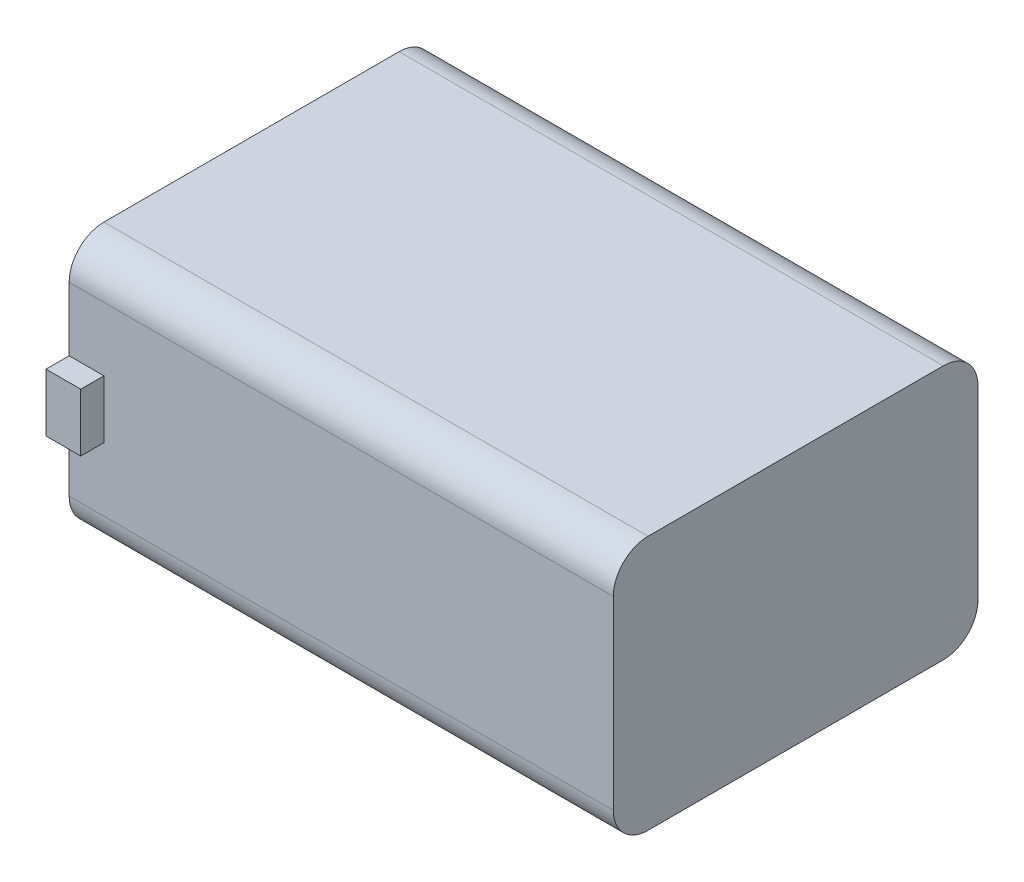
from build123d import *

# Parameters (mm, degrees)
SKETCH_1_W      = 47
SKETCH_1_H      = 31.5
EXTRUDE_1_DEPTH = 11
FILLET_1_R      = 3
SKETCH_2_W      = 10
SKETCH_2_H      = 5
EXTRUDE_2_DEPTH = 3


with BuildPart() as part:
    # ｽｹｯﾁ1 → ﾎﾞｽ - 押し出し1 (new, symmetric)
    with BuildSketch(Plane(origin=(0, 0, 0), x_dir=(1, 0, 0), z_dir=(0, 1, 0))):
        Rectangle(SKETCH_1_W, SKETCH_1_H)
    extrude(amount=EXTRUDE_1_DEPTH, both=True)

    # ﾌｨﾚｯﾄ1
    fillet_1_edges = [part.edges().sort_by_distance(p)[0] for p in [
        (0, 11, 15.75),
        (0, -11, 15.75),
        (0, -11, -15.75),
        (0, 11, -15.75),
    ]]
    fillet(fillet_1_edges, radius=FILLET_1_R)

    # ｽｹｯﾁ2 → ﾎﾞｽ - 押し出し2 (add)
    with BuildSketch(Plane.ZY.offset(23.5)):
        with Locations((12.75, 0)):
            Rectangle(SKETCH_2_W, SKETCH_2_H)
    extrude(amount=-EXTRUDE_2_DEPTH)


solid = part.part
